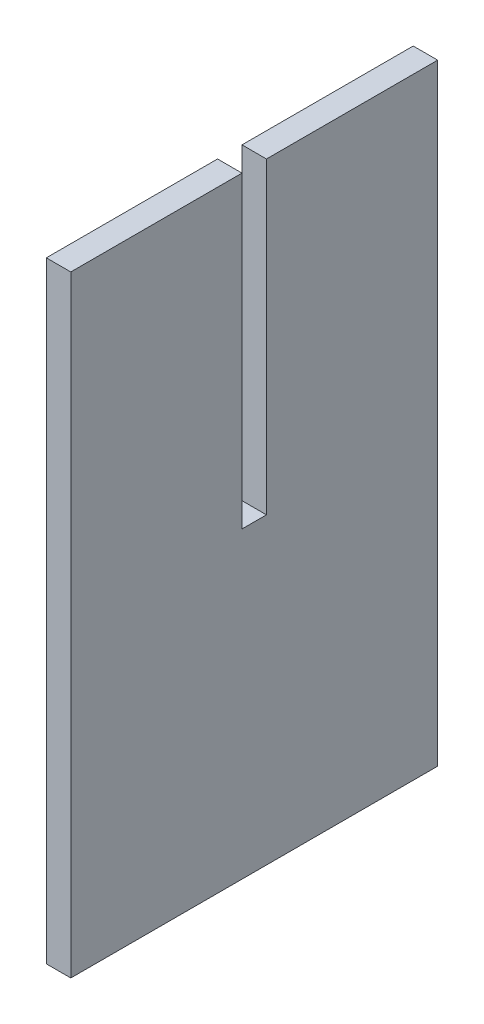
from build123d import *

# Parameters (mm, degrees)
SKETCH_1_W          = 30
SKETCH_1_H          = 50
EXTRUDE_1_DEPTH     = 2
SKETCH_2_W          = 2
SKETCH_2_H          = 25.2
CUT_EXTRUDE_1_DEPTH = 2


with BuildPart() as part:
    # 草图1 → 凸台-拉伸1 (new body)
    with BuildSketch(Plane(origin=(0, 0, 0), x_dir=(0, 0, -1), z_dir=(1, 0, 0))):
        with Locations((15, -25)):
            Rectangle(SKETCH_1_W, SKETCH_1_H)
    extrude(amount=EXTRUDE_1_DEPTH)

    # 草图2 → 切除-拉伸1 (cut)
    with BuildSketch(Plane(origin=(2, 0, 0), x_dir=(0, 0, -1), z_dir=(1, 0, 0))):
        with Locations((15, -12.6)):
            Rectangle(SKETCH_2_W, SKETCH_2_H)
    extrude(amount=-CUT_EXTRUDE_1_DEPTH, mode=Mode.SUBTRACT)


solid = part.part
